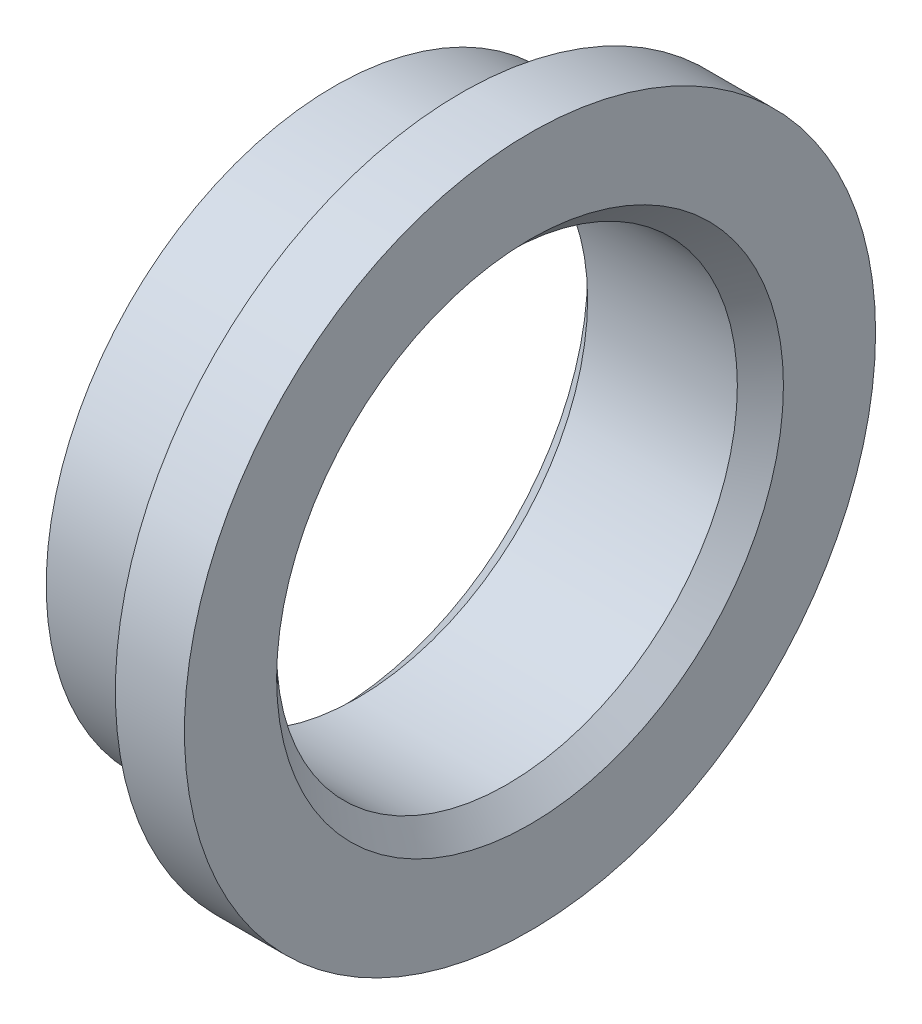
from build123d import *

# Parameters (mm, degrees)
CHAMFER_1_SIZE = 1


with BuildPart() as part:
    # 草图1 → 旋转1 (revolve)
    with BuildSketch(Plane.XY, mode=Mode.PRIVATE) as revolve_1_sk:
        Polygon((0, 10), (8.5, 10), (8.5, 15), (5.5, 15), (5.5, 12.5), (0, 12.5), align=None)
    revolve(revolve_1_sk.sketch.rotate(Axis((0, 0, 0), (-1, 0, 0)), 90), axis=Axis((0, 0, 0), (-1, 0, 0)))

    # 倒角1
    chamfer_1_edges = [part.edges().sort_by_distance(p)[0] for p in [
        (8.5, 0, 10),
        (0, 0, 10),
    ]]
    chamfer(chamfer_1_edges, length=CHAMFER_1_SIZE)


solid = part.part
